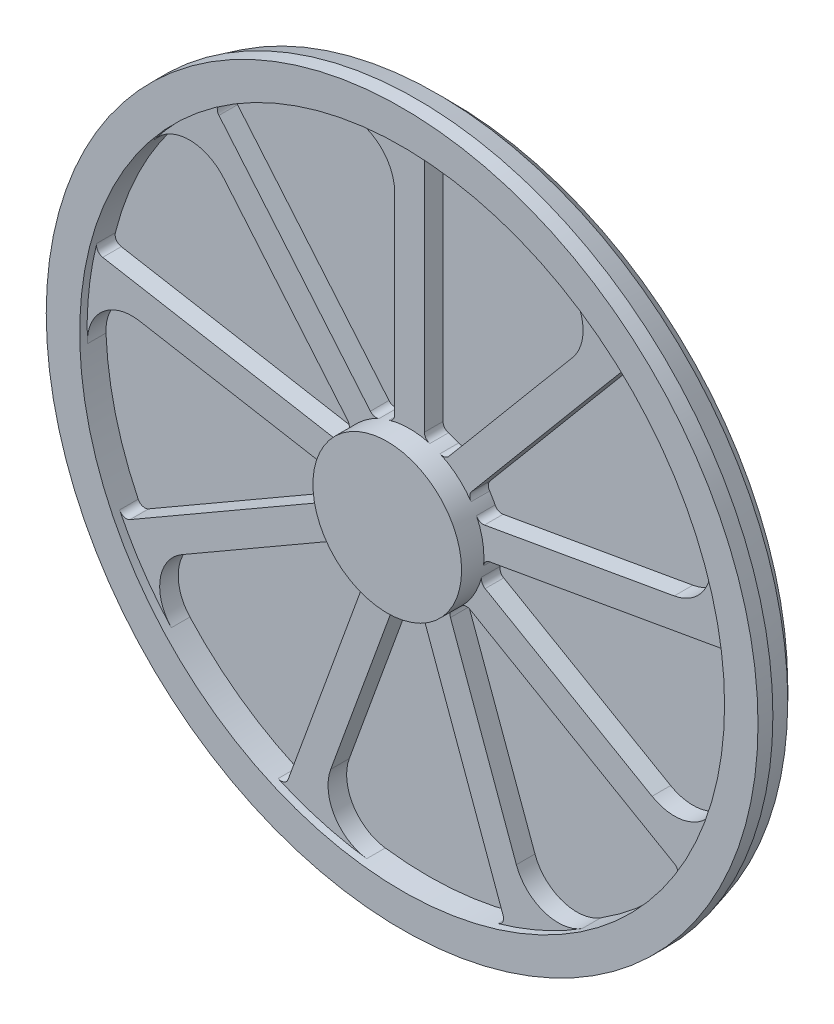
from build123d import *
from OCP.BRepFilletAPI import BRepFilletAPI_MakeFillet

# Parameters (mm, degrees)
BOSS_EXTRUDE1_DEPTH        = 25
FILLET1_R1                 = 60
FILLET1_R2                 = 10
CIRPATTERN1_COUNT          = 9
FILLET1_OF_CIRPATTERN1_R1  = 60
FILLET1_OF_CIRPATTERN1_R2  = 10
FILLET1_OF_CIRPATTERN1_R3  = 60
FILLET1_OF_CIRPATTERN1_R4  = 10
FILLET1_OF_CIRPATTERN1_R5  = 60
FILLET1_OF_CIRPATTERN1_R6  = 10
FILLET1_OF_CIRPATTERN1_R7  = 60
FILLET1_OF_CIRPATTERN1_R8  = 10
FILLET1_OF_CIRPATTERN1_R9  = 60
FILLET1_OF_CIRPATTERN1_R10 = 10
FILLET1_OF_CIRPATTERN1_R11 = 60
FILLET1_OF_CIRPATTERN1_R12 = 10
FILLET1_OF_CIRPATTERN1_R13 = 60
FILLET1_OF_CIRPATTERN1_R14 = 10
FILLET1_OF_CIRPATTERN1_R15 = 60
FILLET1_OF_CIRPATTERN1_R16 = 10


with BuildPart() as part:
    # Sketch2 → Revolve1 (revolve)
    with BuildSketch(Plane(origin=(0, 0, 0), x_dir=(0, 0, -1), z_dir=(1, 0, 0)), mode=Mode.PRIVATE) as revolve1_sk:
        Polygon((-65, 478.75), (-65, 433.75), (-30, 433.75), (-30, 100), (-85, 100), (-85, 0), (0, 0), (0, 453.75), (-17.679491924, 471.429491924), (-45, 478.75), align=None)
    revolve(revolve1_sk.sketch.rotate(Axis((0, 0, 0), (0, 0, -1)), 90), axis=Axis((0, 0, 0), (0, 0, -1)))

    # Sketch3 → Boss-Extrude1 (add)
    with BuildSketch(Plane.XY.offset(30)):
        with BuildLine():
            Line((20, 97.979589711), (20, 433.288659556))
            ThreePointArc((20, 433.288659556), (0, 433.75), (-20, 433.288659556))
            Line((-20, 433.288659556), (-20, 97.979589711))
            ThreePointArc((-20, 97.979589711), (0, 100), (20, 97.979589711))
        make_face()
    boss_extrude1 = extrude(amount=BOSS_EXTRUDE1_DEPTH)

    # Fillet1: one fillet with a radius per group of edges: ONE call of the kernel's fillet builder (fillet() takes one radius for all edges)
    fillet1_edges_1 = [part.edges().sort_by_distance(p)[0] for p in [
        (-20, 433.288659556, 42.5),
    ]]
    fillet1_edges_2 = [part.edges().sort_by_distance(p)[0] for p in [
        (20, 433.288659556, 42.5),
        (20, 97.979589711, 42.5),
        (-20, 97.979589711, 42.5),
    ]]
    fillet1 = BRepFilletAPI_MakeFillet(part.part.solid().wrapped)
    for e in fillet1_edges_1:
        fillet1.Add(FILLET1_R1, e.wrapped)
    for e in fillet1_edges_2:
        fillet1.Add(FILLET1_R2, e.wrapped)
    add(Compound.cast(fillet1.Shape()), mode=Mode.REPLACE)

    # CirPattern1: Boss-Extrude1 ×9 about axis
    cirpattern1_axis = Axis((0, 0, 0), (0, 0, 1))
    for i in range(1, CIRPATTERN1_COUNT):
        add(boss_extrude1.rotate(cirpattern1_axis, i * 360 / CIRPATTERN1_COUNT))

    # Fillet1 of CirPattern1: one fillet with a radius per group of edges: ONE call of the kernel's fillet builder (fillet() takes one radius for all edges)
    fillet1_of_cirpattern1_edges_1 = [part.edges().sort_by_distance(p)[0] for p in [
        (-293.833470643, 319.062617726, 42.5),
    ]]
    fillet1_of_cirpattern1_edges_2 = [part.edges().sort_by_distance(p)[0] for p in [
        (-263.191692918, 344.774122113, 42.5),
        (-47.659177406, 87.912472431, 42.5),
        (-78.300955131, 62.200968044, 42.5),
    ]]
    fillet1_of_cirpattern1_edges_3 = [part.edges().sort_by_distance(p)[0] for p in [
        (-430.178994777, 55.543631075, 42.5),
    ]]
    fillet1_of_cirpattern1_edges_4 = [part.edges().sort_by_distance(p)[0] for p in [
        (-423.23306767, 94.935941196, 42.5),
        (-93.018096031, 36.710132262, 42.5),
        (-99.964023138, -2.682177858, 42.5),
    ]]
    fillet1_of_cirpattern1_edges_5 = [part.edges().sort_by_distance(p)[0] for p in [
        (-365.238986347, -233.964837854, 42.5),
    ]]
    fillet1_of_cirpattern1_edges_6 = [part.edges().sort_by_distance(p)[0] for p in [
        (-385.238986347, -199.323821702, 42.5),
        (-94.852813742, -31.66928678, 42.5),
        (-74.852813742, -66.310302931, 42.5),
    ]]
    fillet1_of_cirpattern1_edges_7 = [part.edges().sort_by_distance(p)[0] for p in [
        (-129.399597027, -413.998558922, 42.5),
    ]]
    fillet1_of_cirpattern1_edges_8 = [part.edges().sort_by_distance(p)[0] for p in [
        (-166.987301859, -400.317753189, 42.5),
        (-52.304845732, -85.230294573, 42.5),
        (-14.7171409, -98.911100306, 42.5),
    ]]
    fillet1_of_cirpattern1_edges_9 = [part.edges().sort_by_distance(p)[0] for p in [
        (166.987301859, -400.317753189, 42.5),
    ]]
    fillet1_of_cirpattern1_edges_10 = [part.edges().sort_by_distance(p)[0] for p in [
        (129.399597027, -413.998558922, 42.5),
        (14.7171409, -98.911100306, 42.5),
        (52.304845732, -85.230294573, 42.5),
    ]]
    fillet1_of_cirpattern1_edges_11 = [part.edges().sort_by_distance(p)[0] for p in [
        (385.238986347, -199.323821702, 42.5),
    ]]
    fillet1_of_cirpattern1_edges_12 = [part.edges().sort_by_distance(p)[0] for p in [
        (365.238986347, -233.964837854, 42.5),
        (74.852813742, -66.310302931, 42.5),
        (94.852813742, -31.66928678, 42.5),
    ]]
    fillet1_of_cirpattern1_edges_13 = [part.edges().sort_by_distance(p)[0] for p in [
        (423.23306767, 94.935941196, 42.5),
    ]]
    fillet1_of_cirpattern1_edges_14 = [part.edges().sort_by_distance(p)[0] for p in [
        (430.178994777, 55.543631075, 42.5),
        (99.964023138, -2.682177858, 42.5),
        (93.018096031, 36.710132262, 42.5),
    ]]
    fillet1_of_cirpattern1_edges_15 = [part.edges().sort_by_distance(p)[0] for p in [
        (263.191692918, 344.774122113, 42.5),
    ]]
    fillet1_of_cirpattern1_edges_16 = [part.edges().sort_by_distance(p)[0] for p in [
        (293.833470643, 319.062617726, 42.5),
        (78.300955131, 62.200968044, 42.5),
        (47.659177406, 87.912472431, 42.5),
    ]]
    fillet1_of_cirpattern1 = BRepFilletAPI_MakeFillet(part.part.solid().wrapped)
    for e in fillet1_of_cirpattern1_edges_1:
        fillet1_of_cirpattern1.Add(FILLET1_OF_CIRPATTERN1_R1, e.wrapped)
    for e in fillet1_of_cirpattern1_edges_2:
        fillet1_of_cirpattern1.Add(FILLET1_OF_CIRPATTERN1_R2, e.wrapped)
    for e in fillet1_of_cirpattern1_edges_3:
        fillet1_of_cirpattern1.Add(FILLET1_OF_CIRPATTERN1_R3, e.wrapped)
    for e in fillet1_of_cirpattern1_edges_4:
        fillet1_of_cirpattern1.Add(FILLET1_OF_CIRPATTERN1_R4, e.wrapped)
    for e in fillet1_of_cirpattern1_edges_5:
        fillet1_of_cirpattern1.Add(FILLET1_OF_CIRPATTERN1_R5, e.wrapped)
    for e in fillet1_of_cirpattern1_edges_6:
        fillet1_of_cirpattern1.Add(FILLET1_OF_CIRPATTERN1_R6, e.wrapped)
    for e in fillet1_of_cirpattern1_edges_7:
        fillet1_of_cirpattern1.Add(FILLET1_OF_CIRPATTERN1_R7, e.wrapped)
    for e in fillet1_of_cirpattern1_edges_8:
        fillet1_of_cirpattern1.Add(FILLET1_OF_CIRPATTERN1_R8, e.wrapped)
    for e in fillet1_of_cirpattern1_edges_9:
        fillet1_of_cirpattern1.Add(FILLET1_OF_CIRPATTERN1_R9, e.wrapped)
    for e in fillet1_of_cirpattern1_edges_10:
        fillet1_of_cirpattern1.Add(FILLET1_OF_CIRPATTERN1_R10, e.wrapped)
    for e in fillet1_of_cirpattern1_edges_11:
        fillet1_of_cirpattern1.Add(FILLET1_OF_CIRPATTERN1_R11, e.wrapped)
    for e in fillet1_of_cirpattern1_edges_12:
        fillet1_of_cirpattern1.Add(FILLET1_OF_CIRPATTERN1_R12, e.wrapped)
    for e in fillet1_of_cirpattern1_edges_13:
        fillet1_of_cirpattern1.Add(FILLET1_OF_CIRPATTERN1_R13, e.wrapped)
    for e in fillet1_of_cirpattern1_edges_14:
        fillet1_of_cirpattern1.Add(FILLET1_OF_CIRPATTERN1_R14, e.wrapped)
    for e in fillet1_of_cirpattern1_edges_15:
        fillet1_of_cirpattern1.Add(FILLET1_OF_CIRPATTERN1_R15, e.wrapped)
    for e in fillet1_of_cirpattern1_edges_16:
        fillet1_of_cirpattern1.Add(FILLET1_OF_CIRPATTERN1_R16, e.wrapped)
    add(Compound.cast(fillet1_of_cirpattern1.Shape()), mode=Mode.REPLACE)


solid = part.part
